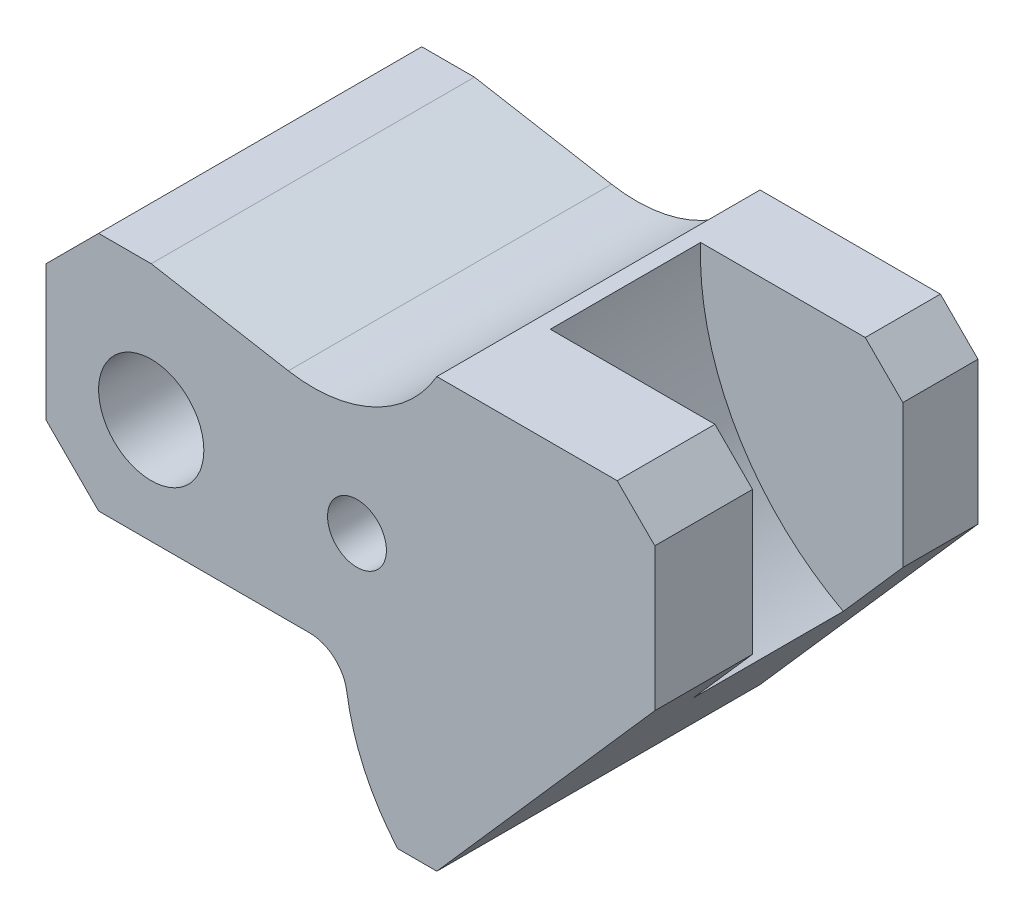
from build123d import *

# Parameters (mm, degrees)
SKETCH1_R           = 7
BOSS_EXTRUDE1_DEPTH = 43
CUT_EXTRUDE1_START  = -10
SKETCH2_R           = 35.868634871
CUT_EXTRUDE1_DEPTH  = 20
SKETCH3_R           = 3.917707096
CUT_EXTRUDE2_DEPTH  = 23


with BuildPart() as part:
    # Sketch1 → Boss-Extrude1 (new body)
    with BuildSketch(Plane.XY):
        with BuildLine():
            Line((-14, -7), (-14, 11))
            Line((-14, 11), (-7, 18))
            Line((-7, 18), (0, 18))
            Line((0, 18), (18.243084988, 14.783251905))
            ThreePointArc((18.243084988, 14.783251905), (29.574972961, 16.276069151), (38, 24))
            Line((38, 24), (62, 24))
            Line((62, 24), (67, 19))
            Line((67, 19), (67, 0))
            Line((67, 0), (38, -33))
            Line((38, -33), (32.788067397, -33))
            ThreePointArc((32.788067397, -33), (28.3490952, -26.115672061), (26.012264997, -18.264705882))
            ThreePointArc((26.012264997, -18.264705882), (24.331862036, -15.213413768), (21.066626255, -14))
            Line((21.066626255, -14), (-7, -14))
            Line((-7, -14), (-14, -7))
        make_face()
        Circle(SKETCH1_R, mode=Mode.SUBTRACT)
    extrude(amount=BOSS_EXTRUDE1_DEPTH)

    # Sketch2 → Cut-Extrude1 (cut)
    with BuildSketch(Plane(origin=(0, 0, 0), x_dir=(-1, 0, 0), z_dir=(0, 0, -1)).offset(CUT_EXTRUDE1_START)):
        with Locations((-75.938611571, 22.638320419)):
            Circle(SKETCH2_R)
    extrude(amount=-CUT_EXTRUDE1_DEPTH, mode=Mode.SUBTRACT)

    # Sketch3 → Cut-Extrude2 (cut)
    with BuildSketch(Plane.XY.offset(43)):
        with Locations((27.374932955, 0.618357786)):
            Circle(SKETCH3_R)
    extrude(amount=-CUT_EXTRUDE2_DEPTH, mode=Mode.SUBTRACT)


solid = part.part
